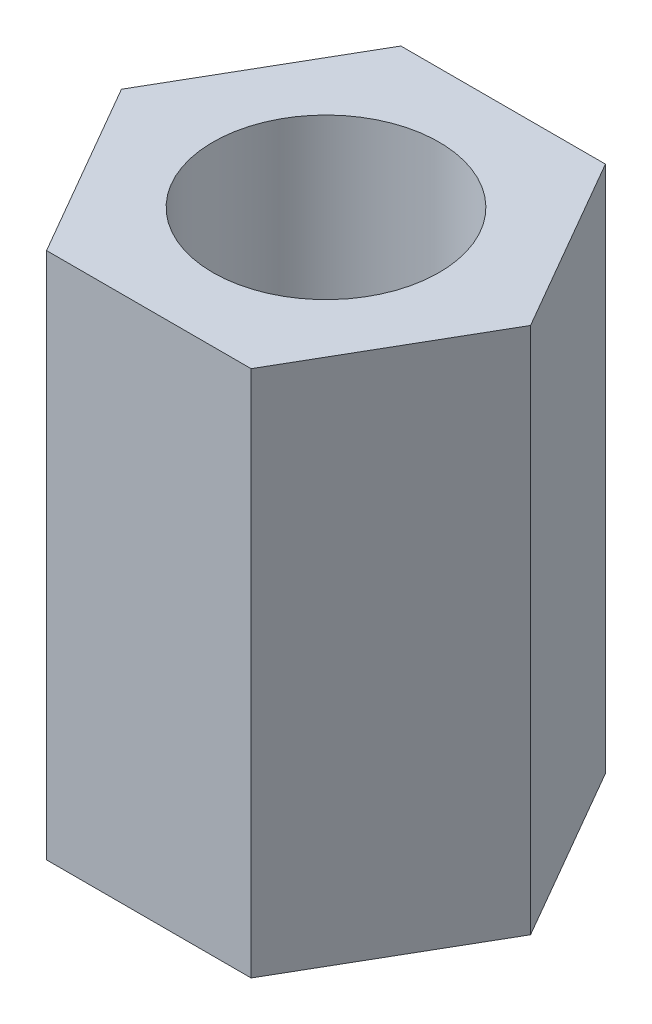
from build123d import *

# Parameters (mm, degrees)
SKETCH_1_R      = 1.5
EXTRUDE_1_DEPTH = 7


with BuildPart() as part:
    # 草图1 → 凸台-拉伸1 (new body)
    with BuildSketch(Plane(origin=(0, 0, 0), x_dir=(1, 0, 0), z_dir=(0, 1, 0))):
        Polygon((1.356773133, -2.35), (2.713546265, 0), (1.356773133, 2.35), (-1.356773133, 2.35), (-2.713546265, 0), (-1.356773133, -2.35), align=None)
        with Locations(Location((0, 0, 0), (0, 0, 270))):
            Circle(SKETCH_1_R, mode=Mode.SUBTRACT)
    extrude(amount=EXTRUDE_1_DEPTH)


solid = part.part
